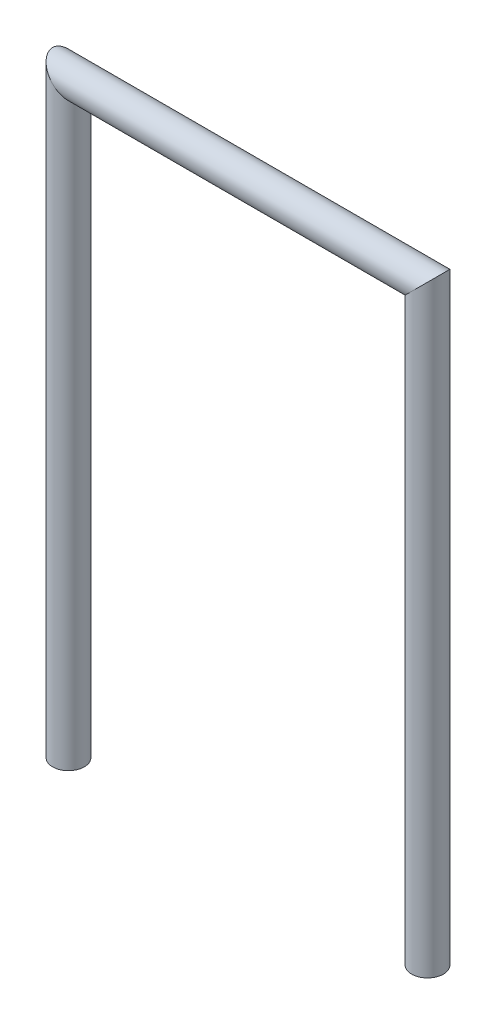
from build123d import *

# Parameters (mm, degrees)
SKETCH2_R = 15


with BuildPart() as part:
    # Sweep1: sweep along a path in Sketch1
    with BuildLine(Plane.XY) as sweep1_path:
        Line((0, 0), (0, 560))
        Line((0, 560), (340, 560))
        Line((340, 560), (340, 0))
    # Sketch2 → Sweep1 (sweep)
    with BuildSketch(Plane(origin=(0, 0, 0), x_dir=(1, 0, 0), z_dir=(0, 1, 0))):
        Circle(SKETCH2_R)
    sweep(path=sweep1_path.line, transition=Transition.RIGHT)


solid = part.part
